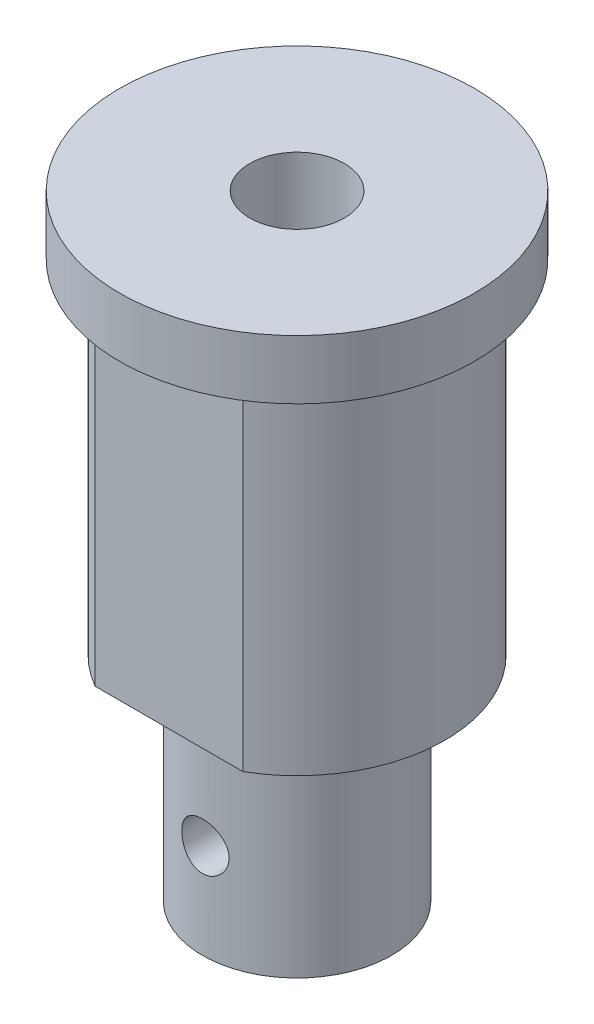
from build123d import *

# Parameters (mm, degrees)
SKETCH2_W               = 12.5
SKETCH2_H               = 2
CUT_EXTRUDE1_DEPTH      = 29
CUT_EXTRUDE2_REACH      = 60.017
CUT_EXTRUDE2_END_RADIUS = 8
SKETCH4_R               = 2
SKETCH5_R               = 8
CUT_EXTRUDE3_DEPTH      = 2


with BuildPart() as part:
    # Sketch1 → Revolve1 (revolve)
    with BuildSketch(Plane.XY, mode=Mode.PRIVATE) as revolve1_sk:
        Polygon((4, 0), (4, 54), (15, 54), (15, 49), (12.5, 49), (12.5, 20), (8, 20), (8, 0), align=None)
    revolve(revolve1_sk.sketch.rotate(Axis((0, 0, 0), (0, 1, 0)), 90), axis=Axis((0, 0, 0), (0, 1, 0)))

    # Sketch2 → Cut-Extrude1 (cut)
    with BuildSketch(Plane.XZ.offset(-20)):
        with Locations((0, 11.825317547)):
            Rectangle(SKETCH2_W, SKETCH2_H)
    extrude(amount=-CUT_EXTRUDE1_DEPTH, mode=Mode.SUBTRACT)

    # Cut-Extrude2: up to this cylinder (the profile starts inside it)
    cut_extrude2_end = Plane(origin=(0, 10, 0), z_dir=(0, -1, 0)) * Cylinder(CUT_EXTRUDE2_END_RADIUS, 137.034, mode=Mode.PRIVATE)
    # Sketch4 → Cut-Extrude2 (cut, up to the surface)
    with BuildSketch(Plane.XY, mode=Mode.PRIVATE) as cut_extrude2_sk1:
        with Locations(Location((0, 10, 0), (0, 0, 180))):
            Circle(SKETCH4_R)
    cut_extrude2_tool1 = extrude(cut_extrude2_sk1.sketch, amount=CUT_EXTRUDE2_REACH, mode=Mode.PRIVATE) & cut_extrude2_end
    add(cut_extrude2_tool1.solids().sort_by_distance((0, 10, 0))[0], mode=Mode.SUBTRACT)

    # Sketch5 → Cut-Extrude3 (cut)
    with BuildSketch(Plane.XZ):
        with Locations(Location((0, 0, 0), (0, 0, 270))):
            Circle(SKETCH5_R)
    extrude(amount=-CUT_EXTRUDE3_DEPTH, mode=Mode.SUBTRACT)


solid = part.part
